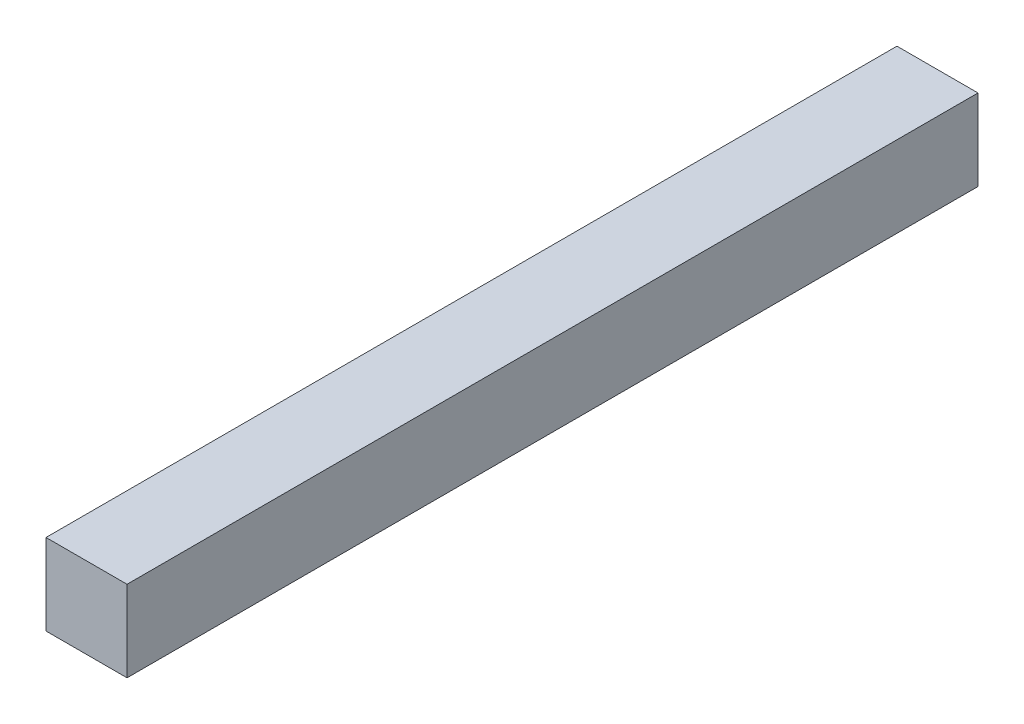
from build123d import *

# Parameters (mm, degrees)
SKETCH1_W           = 6.35
SKETCH1_H           = 6.35
BOSS_EXTRUDE1_DEPTH = 66.675


with BuildPart() as part:
    # Sketch1 → Boss-Extrude1 (new body)
    with BuildSketch(Plane.XY):
        with Locations((-3.175, 3.175)):
            Rectangle(SKETCH1_W, SKETCH1_H)
    extrude(amount=BOSS_EXTRUDE1_DEPTH)


solid = part.part
